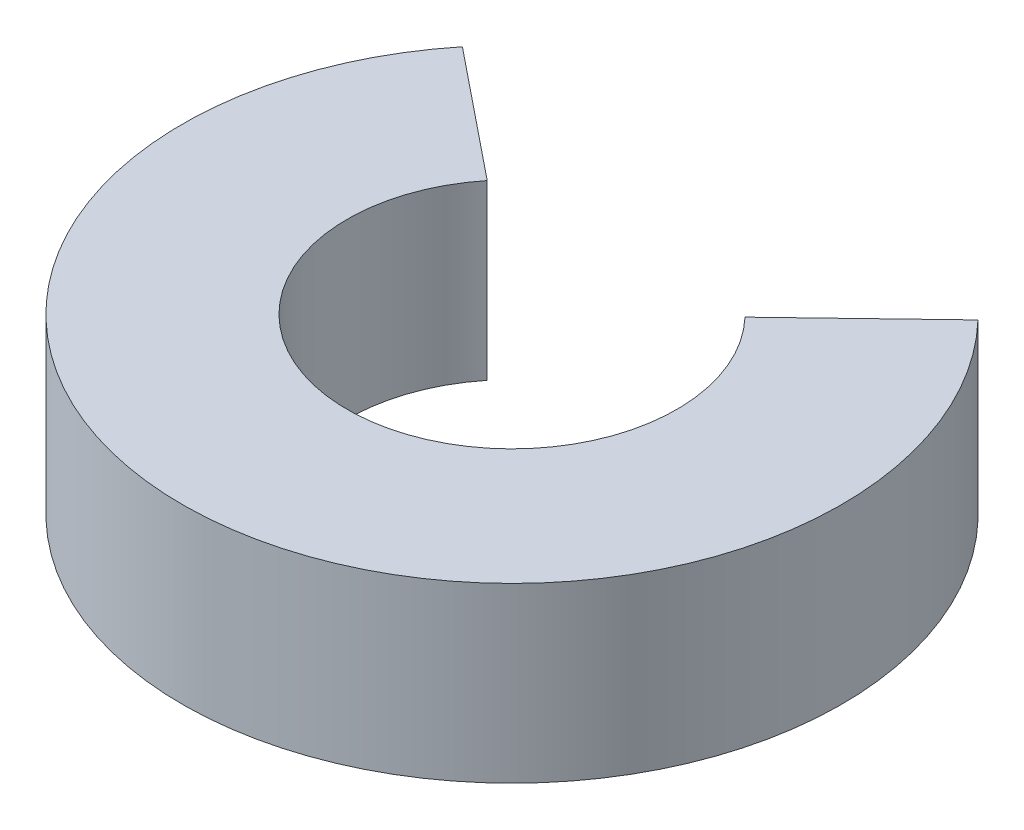
from build123d import *

# Parameters (mm, degrees)
BOSS_EXTRU_1_DEPTH = 4.2


with BuildPart() as part:
    # Esquisse1 → Boss.-Extru.1 (new body)
    with BuildSketch(Plane(origin=(0, 0, 0), x_dir=(1, 0, 0), z_dir=(0, 1, 0))):
        with BuildLine():
            Line((-6.22678121, 5.022668192), (-3.113390605, 2.511334096))
            ThreePointArc((-3.113390605, 2.511334096), (0.171634121, -3.99631602), (2.886609395, 2.769022607))
            Line((2.886609395, 2.769022607), (5.77321879, 5.538045214))
            ThreePointArc((5.77321879, 5.538045214), (0.343268242, -7.992632039), (-6.22678121, 5.022668192))
        make_face()
    extrude(amount=BOSS_EXTRU_1_DEPTH)


solid = part.part
